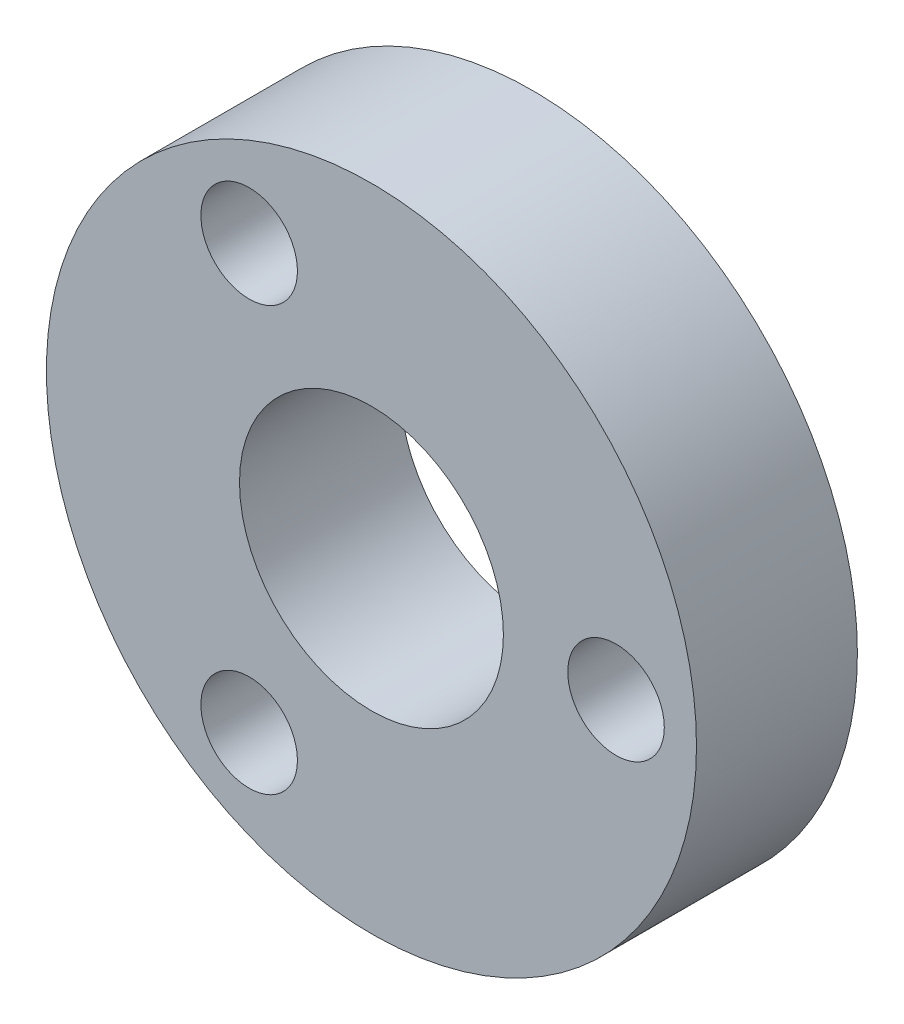
from build123d import *

# Parameters (mm, degrees)
SKETCH2_R           = 10.1
SKETCH2_R_2         = 4.1
SKETCH2_R_3         = 1.5
BOSS_EXTRUDE1_DEPTH = 5


with BuildPart() as part:
    # Sketch2 → Boss-Extrude1 (new body)
    with BuildSketch(Plane.XY):
        Circle(SKETCH2_R)
        Circle(SKETCH2_R_2, mode=Mode.SUBTRACT)
        with Locations((7.6, 0)):
            Circle(SKETCH2_R_3, mode=Mode.SUBTRACT)
        with Locations((-3.8, -6.581793069)):
            Circle(SKETCH2_R_3, mode=Mode.SUBTRACT)
        with Locations((-3.8, 6.581793069)):
            Circle(SKETCH2_R_3, mode=Mode.SUBTRACT)
    extrude(amount=BOSS_EXTRUDE1_DEPTH)


solid = part.part
